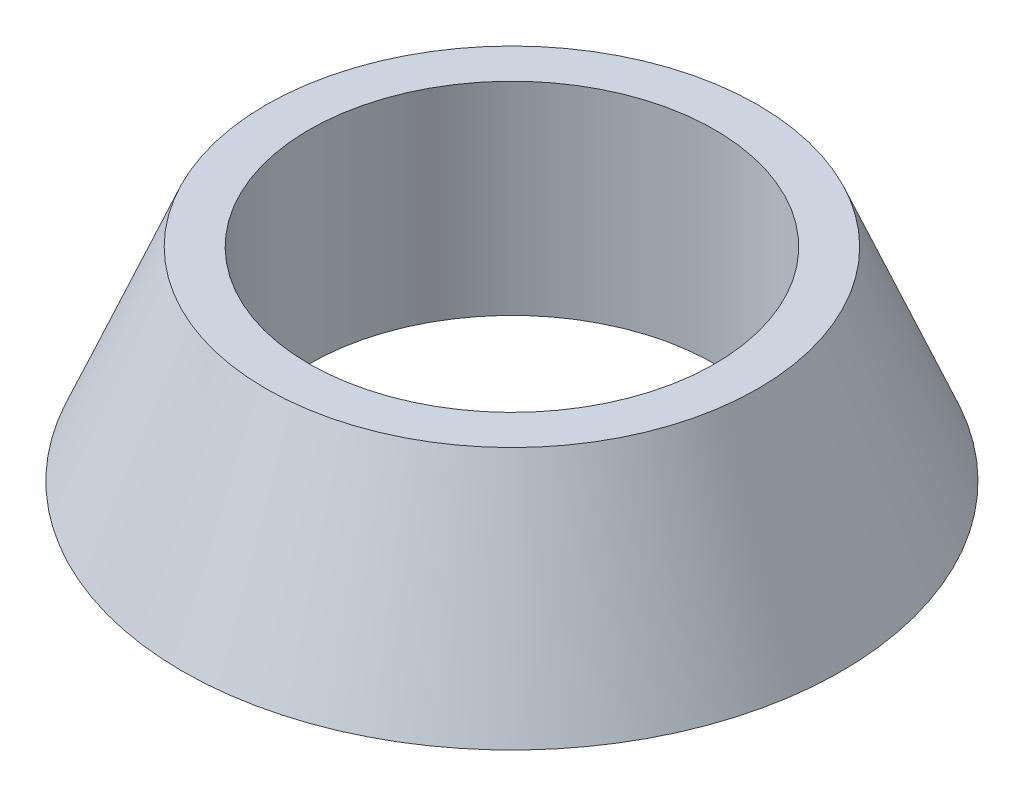
from build123d import *


with BuildPart() as part:
    # Szkic1 → Obrót1 (revolve)
    with BuildSketch(Plane.XY, mode=Mode.PRIVATE) as obr_t1_sk:
        Polygon((8, 4), (8, -4), (13, -4), (9.7, 4), align=None)
    revolve(obr_t1_sk.sketch.rotate(Axis((0, 7.920708236, 0), (0, -1, 0)), 90), axis=Axis((0, 7.920708236, 0), (0, -1, 0)))


solid = part.part
